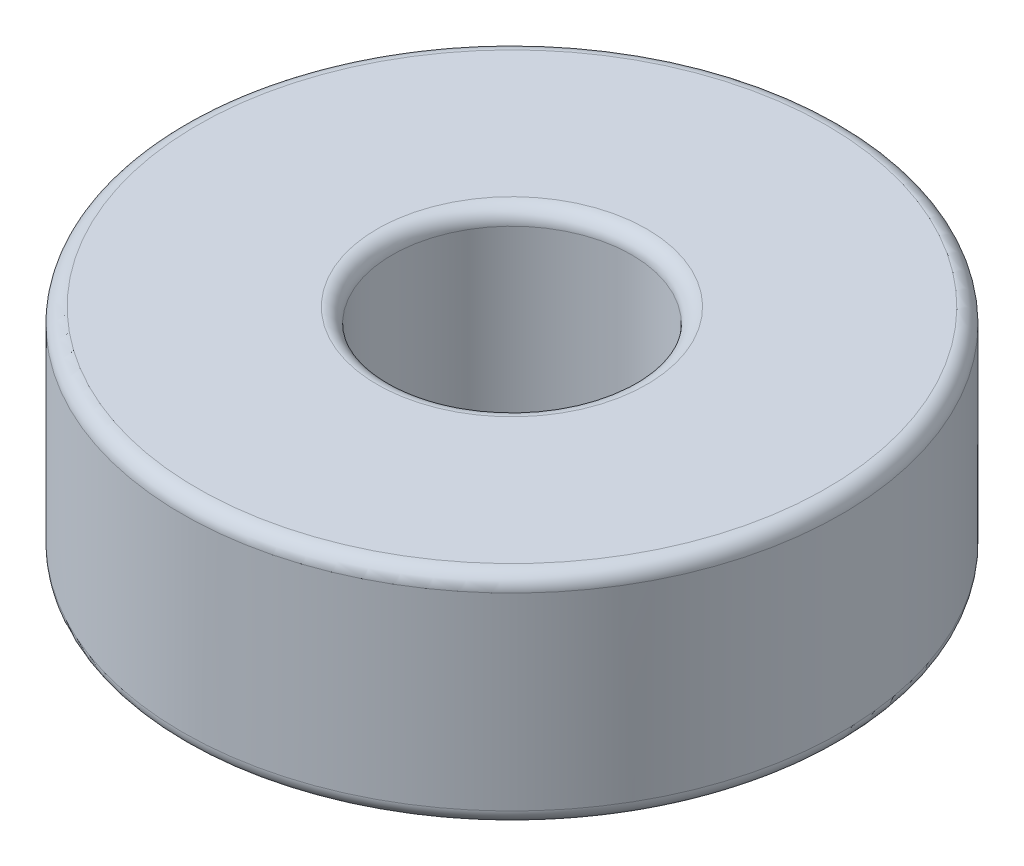
from build123d import *

# Parameters (mm, degrees)
SKETCH1_W = 7
SKETCH1_H = 7.3
FILLET1_R = 0.5


with BuildPart() as part:
    # Sketch1 → Revolve1 (revolve)
    with BuildSketch(Plane.XY, mode=Mode.PRIVATE) as revolve1_sk:
        with Locations((-7.5, 3.65)):
            Rectangle(SKETCH1_W, SKETCH1_H)
    revolve(revolve1_sk.sketch.rotate(Axis((0, 0, 0), (0, 1, 0)), 270), axis=Axis((0, 0, 0), (0, 1, 0)))

    # Fillet1
    fillet1_edges = [part.edges().sort_by_distance(p)[0] for p in [
        (0, 0, 4),
        (0, 0, 11),
        (0, 7.3, 11),
        (0, 7.3, 4),
    ]]
    fillet(fillet1_edges, radius=FILLET1_R)


solid = part.part
